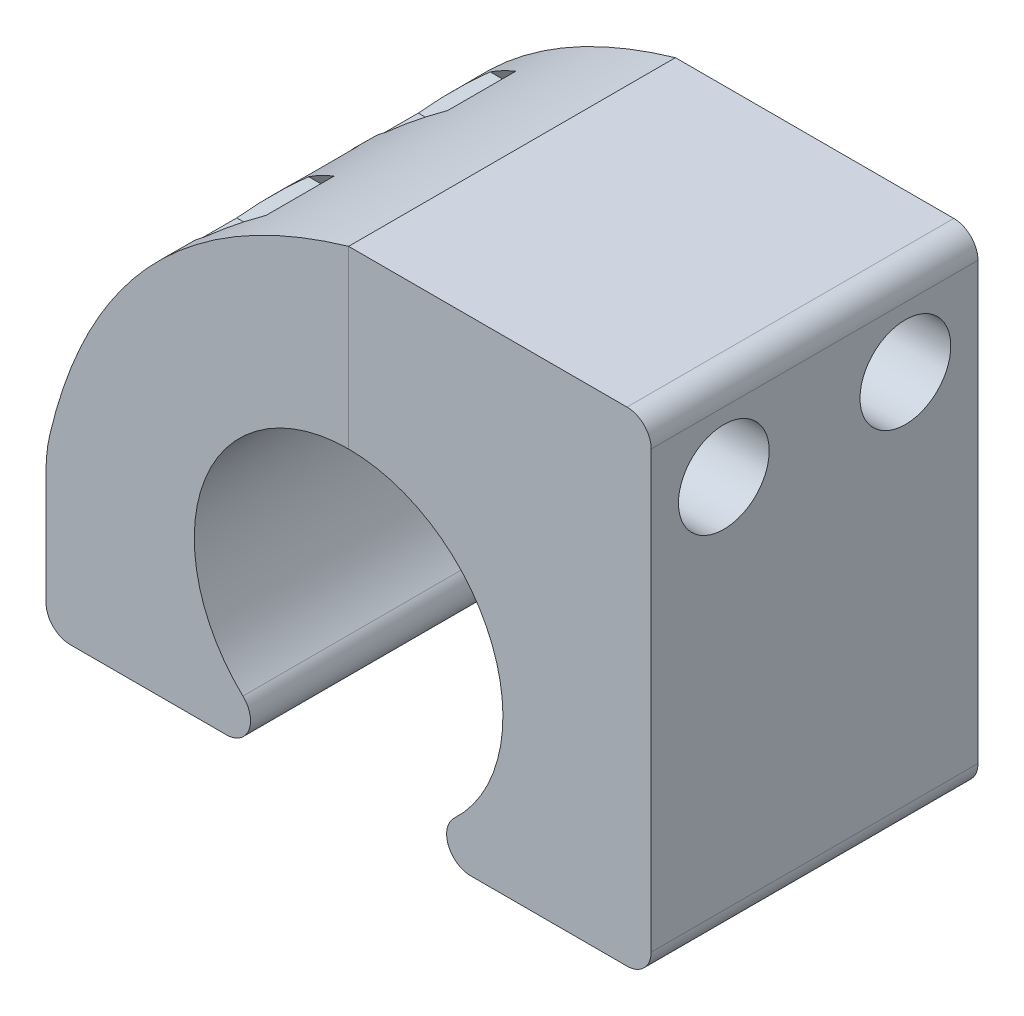
from build123d import *

# Parameters (mm, degrees)
BOSS_EXTRUDE1_DEPTH    = 13.5
FILLET1_R              = 2
SPLIT1_SURFACE_1_BACK  = 70.491
SPLIT1_SURFACE_1_DEPTH = 140.982
SPLIT1_SURFACE_2_BACK  = 70.491
SPLIT1_SURFACE_2_DEPTH = 140.982
SKETCH3_R              = 3.75
CUT_EXTRUDE1_DEPTH     = 10
SKETCH7_R              = 2.25
CUT_EXTRUDE3_DEPTH     = 15
CUT_EXTRUDE2_DEPTH     = 27
FILLET2_R              = 12
SKETCH8_R              = 2.25
CUT_EXTRUDE4_DEPTH     = 25
CUT_EXTRUDE5_DEPTH     = 15
SKETCH10_R             = 2.25
CUT_EXTRUDE6_DEPTH     = 35
CUT_EXTRUDE7_DEPTH     = 17


with BuildPart() as part:
    # Sketch1 → Boss-Extrude1 (new, symmetric)
    with BuildSketch(Plane.XY):
        with BuildLine():
            Line((10.099504938, -12.75), (25, -12.75))
            Line((25, -12.75), (25, 27.25))
            Line((25, 27.25), (-25, 27.25))
            Line((-25, 27.25), (-25, -12.75))
            Line((-25, -12.75), (-10.099504938, -12.75))
            ThreePointArc((-10.099504938, -12.75), (-8.240035358, -11.486459694), (-8.73008054, -9.292372881))
            ThreePointArc((-8.73008054, -9.292372881), (0, 12.75), (8.73008054, -9.292372881))
            ThreePointArc((8.73008054, -9.292372881), (8.240035358, -11.486459694), (10.099504938, -12.75))
        make_face()
    extrude(amount=BOSS_EXTRUDE1_DEPTH, both=True)

    # Fillet1
    fillet1_edges = [part.edges().sort_by_distance(p)[0] for p in [
        (25, 27.25, 0),
        (25, -12.75, 0),
        (-25, -12.75, 0),
    ]]
    fillet(fillet1_edges, radius=FILLET1_R)


with BuildPart() as body_2:
    # Split1: the piece behind the surface
    add(part.part)
    # Split1 surface: a surface, the sketch's curves swept straight by 140.982 mm
    with BuildLine(Plane.XY.offset(13.5).offset(-SPLIT1_SURFACE_1_BACK), mode=Mode.PRIVATE) as split1_surface_1_path:
        Line((0, 27.25), (0, 0))
    split1_surface_1 = Shell.extrude(split1_surface_1_path.wire(), (0 * SPLIT1_SURFACE_1_DEPTH, 0 * SPLIT1_SURFACE_1_DEPTH, 1 * SPLIT1_SURFACE_1_DEPTH))
    split(bisect_by=split1_surface_1, keep=Keep.BOTTOM)

    # Sketch6 → Cut-Extrude2 (cut)
    with BuildSketch(Plane.XY.offset(13.5)):
        with BuildLine():
            Line((-25, 27.25), (-25, 0))
            add(Edge.make_bspline(
                [(0, 27.25), (-20.673557746, 21.233841963), (-25, 0)],
                knots=[0, 0, 0, 1, 1, 1], degree=2))
            Line((0, 27.25), (-25, 27.25))
        make_face()
    extrude(amount=-CUT_EXTRUDE2_DEPTH, mode=Mode.SUBTRACT)

    # Fillet2
    fillet2_edges = [body_2.edges().sort_by_distance(p)[0] for p in [
        (-25, 0, 0),
    ]]
    fillet(fillet2_edges, radius=FILLET2_R)

    # Sketch8 → Cut-Extrude4 (cut)
    with BuildSketch(Plane(origin=(0, 0, 0), x_dir=(0, 0, -1), z_dir=(1, 0, 0))):
        with Locations(Location((7.5, 20.25, 0), (0, 0, 90))):
            Circle(SKETCH8_R)
        with Locations(Location((-7.5, 20.25, 0), (0, 0, 90))):
            Circle(SKETCH8_R)
    extrude(amount=-CUT_EXTRUDE4_DEPTH, mode=Mode.SUBTRACT)

    # Sketch9 → Cut-Extrude5 (cut)
    with BuildSketch(Plane.ZY.offset(25)):
        Polygon((-5.334936491, 24), (-9.665063509, 24), (-11.830127019, 20.25), (-9.665063509, 16.5), (-5.334936491, 16.5), (-3.169872981, 20.25), align=None)
        Polygon((3.169872981, 20.25), (5.334936491, 24), (9.665063509, 24), (11.830127019, 20.25), (9.665063509, 16.5), (5.334936491, 16.5), align=None)
    extrude(amount=-CUT_EXTRUDE5_DEPTH, mode=Mode.SUBTRACT)

    # Sketch10 → Cut-Extrude6 (cut)
    with BuildSketch(Plane.XZ.offset(12.75)):
        with Locations((-18.5, 0)):
            Circle(SKETCH10_R)
    extrude(amount=-CUT_EXTRUDE6_DEPTH, mode=Mode.SUBTRACT)

    # Sketch11 → Cut-Extrude7 (cut)
    with BuildSketch(Plane(origin=(0, 27.25, 0), x_dir=(1, 0, 0), z_dir=(0, 1, 0))):
        Polygon((-14.75, -2.165063509), (-14.75, 2.165063509), (-18.5, 4.330127019), (-22.25, 2.165063509), (-22.25, -2.165063509), (-18.5, -4.330127019), align=None)
    extrude(amount=-CUT_EXTRUDE7_DEPTH, mode=Mode.SUBTRACT)


with BuildPart() as part_1:
    add(part.part)

    # Split1: split by a surface, the side it looks to stays
    # Split1 surface: a surface, the sketch's curves swept straight by 140.982 mm
    with BuildLine(Plane.XY.offset(13.5).offset(-SPLIT1_SURFACE_2_BACK), mode=Mode.PRIVATE) as split1_surface_2_path:
        Line((0, 27.25), (0, 0))
    split1_surface_2 = Shell.extrude(split1_surface_2_path.wire(), (0 * SPLIT1_SURFACE_2_DEPTH, 0 * SPLIT1_SURFACE_2_DEPTH, 1 * SPLIT1_SURFACE_2_DEPTH))
    split(bisect_by=split1_surface_2, keep=Keep.TOP)

    # Sketch3 → Cut-Extrude1 (cut)
    with BuildSketch(Plane(origin=(25, 0, 0), x_dir=(0, 0, -1), z_dir=(1, 0, 0))):
        with Locations(Location((-7.5, 20.25, 0), (0, 0, 90))):
            Circle(SKETCH3_R)
        with Locations(Location((7.5, 20.25, 0), (0, 0, 180))):
            Circle(SKETCH3_R)
    extrude(amount=-CUT_EXTRUDE1_DEPTH, mode=Mode.SUBTRACT)

    # Sketch7 → Cut-Extrude3 (cut)
    with BuildSketch(Plane(origin=(15, 0, 0), x_dir=(0, 0, -1), z_dir=(1, 0, 0))):
        with Locations((-7.5, 20.25)):
            Circle(SKETCH7_R)
        with Locations(Location((7.5, 20.25, 0), (0, 0, 180))):
            Circle(SKETCH7_R)
    extrude(amount=-CUT_EXTRUDE3_DEPTH, mode=Mode.SUBTRACT)


solid = Compound([body_2.part, part_1.part])
